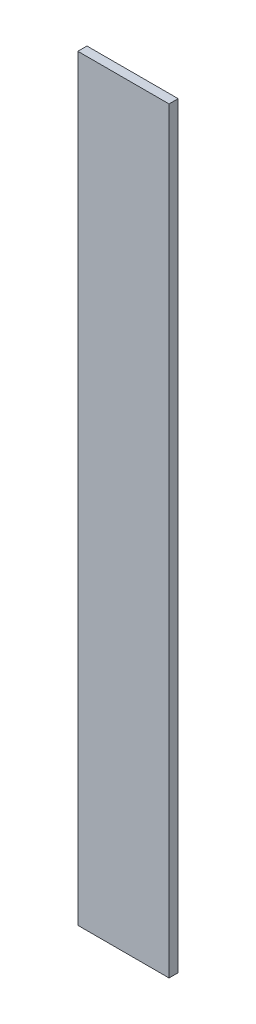
from build123d import *

# Parameters (mm, degrees)
SZKIC1_W                    = 10
SZKIC1_H                    = 83
DODANIE_WYCI_GNI_CIE1_DEPTH = 1


with BuildPart() as part:
    # Szkic1 → Dodanie-wyciągnięcie1 (new body)
    with BuildSketch(Plane.XY):
        with Locations((5, 41.5)):
            Rectangle(SZKIC1_W, SZKIC1_H)
    extrude(amount=DODANIE_WYCI_GNI_CIE1_DEPTH)


solid = part.part
